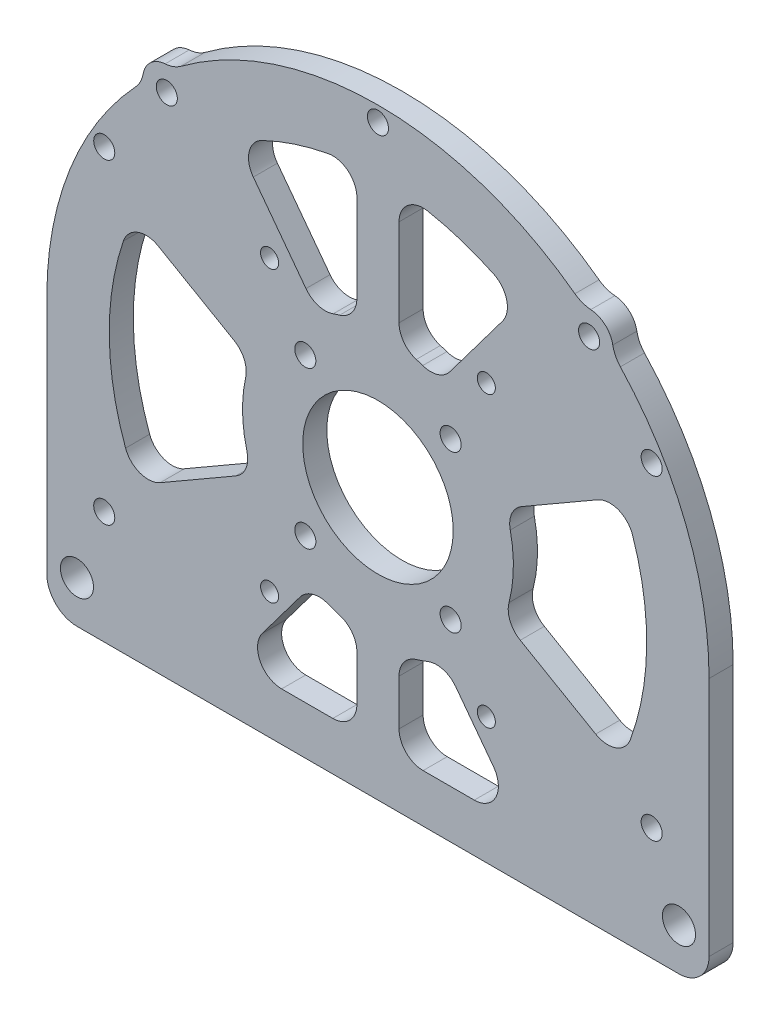
from build123d import *

# Parameters (mm, degrees)
SKETCH_2_R          = 1.25
SKETCH_2_R_2        = 1.75
SKETCH_2_R_3        = 12.5
SKETCH_2_R_4        = 2.55
SKETCH_2_R_5        = 1.5
SKETCH_2_R_6        = 1.55
EXTRUDE_1_DEPTH     = 4
CUT_EXTRUDE_1_DEPTH = 4
FILLET_2_R          = 4
FILLET_3_R          = 4
FILLET_4_R          = 5
SKETCH_4_R          = 1.75
SKETCH_4_R_2        = 1.5
SKETCH_4_R_3        = 2.75
CUT_EXTRUDE_2_DEPTH = 10


with BuildPart() as part:
    # 草图2 → 凸台-拉伸1 (new body)
    with BuildSketch(Plane.XY):
        with BuildLine():
            Line((55, 3), (55, 47.999999928))
            ThreePointArc((55, 47.999999928), (50.85407892, 68.949049075), (39.041357871, 86.739803505))
            ThreePointArc((39.041357871, 86.739803505), (37.739334229, 90.232640986), (34.122629592, 91.135207774))
            ThreePointArc((34.122629592, 91.135207774), (0, 103), (-34.122629592, 91.135207774))
            ThreePointArc((-34.122629592, 91.135207774), (-37.739334229, 90.232640986), (-39.041357871, 86.739803505))
            ThreePointArc((-39.041357871, 86.739803505), (-50.854078907, 68.949049108), (-55, 48))
            Line((-55, 48), (-55, 3))
            Line((-55, 3), (55, 3))
        make_face()
        with Locations((-18, 24)):
            Circle(SKETCH_2_R, mode=Mode.SUBTRACT)
        with Locations((-12.07, 35)):
            Circle(SKETCH_2_R_2, mode=Mode.SUBTRACT)
        with Locations((18, 24)):
            Circle(SKETCH_2_R, mode=Mode.SUBTRACT)
        with Locations((12.07, 35)):
            Circle(SKETCH_2_R_2, mode=Mode.SUBTRACT)
        with Locations((0, 48)):
            Circle(SKETCH_2_R_3, mode=Mode.SUBTRACT)
        with Locations((-12.07, 61)):
            Circle(SKETCH_2_R_2, mode=Mode.SUBTRACT)
        with Locations((-18, 72)):
            Circle(SKETCH_2_R, mode=Mode.SUBTRACT)
        with Locations((12.07, 61)):
            Circle(SKETCH_2_R_2, mode=Mode.SUBTRACT)
        with Locations((18, 72)):
            Circle(SKETCH_2_R, mode=Mode.SUBTRACT)
        with Locations((50, 10)):
            Circle(SKETCH_2_R_4, mode=Mode.SUBTRACT)
        with Locations((45.466333699, 21.75)):
            Circle(SKETCH_2_R_5, mode=Mode.SUBTRACT)
        with Locations((45.466333699, 74.25)):
            Circle(SKETCH_2_R_5, mode=Mode.SUBTRACT)
        with Locations((35.074028853, 87.25)):
            Circle(SKETCH_2_R_6, mode=Mode.SUBTRACT)
        with Locations((-50, 10)):
            Circle(SKETCH_2_R_4, mode=Mode.SUBTRACT)
        with Locations((0, 100.5)):
            Circle(SKETCH_2_R_5, mode=Mode.SUBTRACT)
        with Locations((-45.466333699, 21.75)):
            Circle(SKETCH_2_R_5, mode=Mode.SUBTRACT)
        with Locations((-45.466333699, 74.25)):
            Circle(SKETCH_2_R_5, mode=Mode.SUBTRACT)
        with Locations((-35.074028853, 87.25)):
            Circle(SKETCH_2_R_6, mode=Mode.SUBTRACT)
    extrude(amount=EXTRUDE_1_DEPTH)

    # 草图3 → 切除-拉伸1 (cut)
    with BuildSketch(Plane.XY.offset(4)):
        with BuildLine():
            ThreePointArc((-3.5, 25.773889229), (-7.354360894, 26.735866445), (-10.979461873, 28.360717503))
            Line((-10.979461873, 28.360717503), (-24, 11))
            Line((-24, 11), (-3.5, 11))
            Line((-3.5, 11), (-3.5, 25.773889229))
        make_face()
        with BuildLine():
            Line((-21.175179269, 55.606693298), (-40.502045801, 66.765064893))
            ThreePointArc((-40.502045801, 66.765064893), (-44.635096369, 47.4984557), (-40.070163739, 28.329581794))
            Line((-40.070163739, 28.329581794), (-20.811589784, 39.448524651))
            ThreePointArc((-20.811589784, 39.448524651), (-22.494305888, 47.493835393), (-21.175179269, 55.606693298))
        make_face()
        with BuildLine():
            ThreePointArc((-3.5, 92.500487352), (-13.877512662, 90.425912092), (-23.474999809, 85.966666412))
            Line((-23.474999809, 85.966666412), (-10.084953895, 68.11327186))
            ThreePointArc((-10.084953895, 68.11327186), (-6.874137411, 69.424197414), (-3.5, 70.226110771))
            Line((-3.5, 70.226110771), (-3.5, 92.500487352))
        make_face()
    cut_extrude_1 = extrude(amount=-CUT_EXTRUDE_1_DEPTH, mode=Mode.SUBTRACT)

    # 镜向1: 切除-拉伸1 across plane
    add(cut_extrude_1.mirror(Plane(origin=(0, 0, 0), x_dir=(0, 0, 1), z_dir=(1, 0, 0))), mode=Mode.SUBTRACT)

    # 圆角2
    fillet_2_edges = [part.edges().sort_by_distance(p)[0] for p in [
        (-40.502045801, 66.765064893, 2),
        (-21.175179269, 55.606693298, 2),
        (-20.811589784, 39.448524651, 2),
        (-40.070163739, 28.329581794, 2),
    ]]
    fillet(fillet_2_edges, radius=FILLET_2_R)

    # 圆角3
    fillet_3_edges = [part.edges().sort_by_distance(p)[0] for p in [
        (-3.5, 92.500487352, 2),
        (-3.5, 70.226110771, 2),
        (-10.084953895, 68.11327186, 2),
        (-23.474999809, 85.966666412, 2),
        (-10.979461873, 28.360717503, 2),
        (-3.5, 25.773889229, 2),
        (-3.5, 11, 2),
        (-24, 11, 2),
        (3.5, 70.226110771, 2),
        (3.5, 92.500487352, 2),
        (23.474999809, 85.966666412, 2),
        (10.084953895, 68.11327186, 2),
        (21.175179269, 55.606693298, 2),
        (40.502045801, 66.765064893, 2),
        (40.070163739, 28.329581794, 2),
        (20.811589784, 39.448524651, 2),
        (3.5, 25.773889229, 2),
        (10.979461873, 28.360717503, 2),
        (24, 11, 2),
        (3.5, 11, 2),
    ]]
    fillet(fillet_3_edges, radius=FILLET_3_R)

    # 圆角4
    fillet_4_edges = [part.edges().sort_by_distance(p)[0] for p in [
        (39.041357871, 86.739803505, 2),
        (55, 3, 2),
        (-55, 3, 2),
        (-39.041357871, 86.739803505, 2),
        (-34.122629592, 91.135207774, 2),
        (34.122629592, 91.135207774, 2),
    ]]
    fillet(fillet_4_edges, radius=FILLET_4_R)

    # 草图4 → 切除-拉伸2 (cut)
    with BuildSketch(Plane.XY.offset(4)):
        with Locations((-45.466333699, 74.25)):
            Circle(SKETCH_4_R)
        with Locations((-35.074028853, 87.25)):
            Circle(SKETCH_4_R)
        with Locations((0, 100.5)):
            Circle(SKETCH_4_R)
        with Locations((35.074028853, 87.25)):
            Circle(SKETCH_4_R)
        with Locations((45.466333699, 74.25)):
            Circle(SKETCH_4_R)
        with Locations((18, 72)):
            Circle(SKETCH_4_R_2)
        with Locations((-18, 72)):
            Circle(SKETCH_4_R_2)
        with Locations((-18, 24)):
            Circle(SKETCH_4_R_2)
        with Locations((18, 24)):
            Circle(SKETCH_4_R_2)
        with Locations((50, 10)):
            Circle(SKETCH_4_R_3)
        with Locations((-50, 10)):
            Circle(SKETCH_4_R_3)
        with Locations((45.466333699, 21.75)):
            Circle(SKETCH_4_R)
        with Locations((-45.466333699, 21.75)):
            Circle(SKETCH_4_R)
    extrude(amount=-CUT_EXTRUDE_2_DEPTH, mode=Mode.SUBTRACT)


solid = part.part
